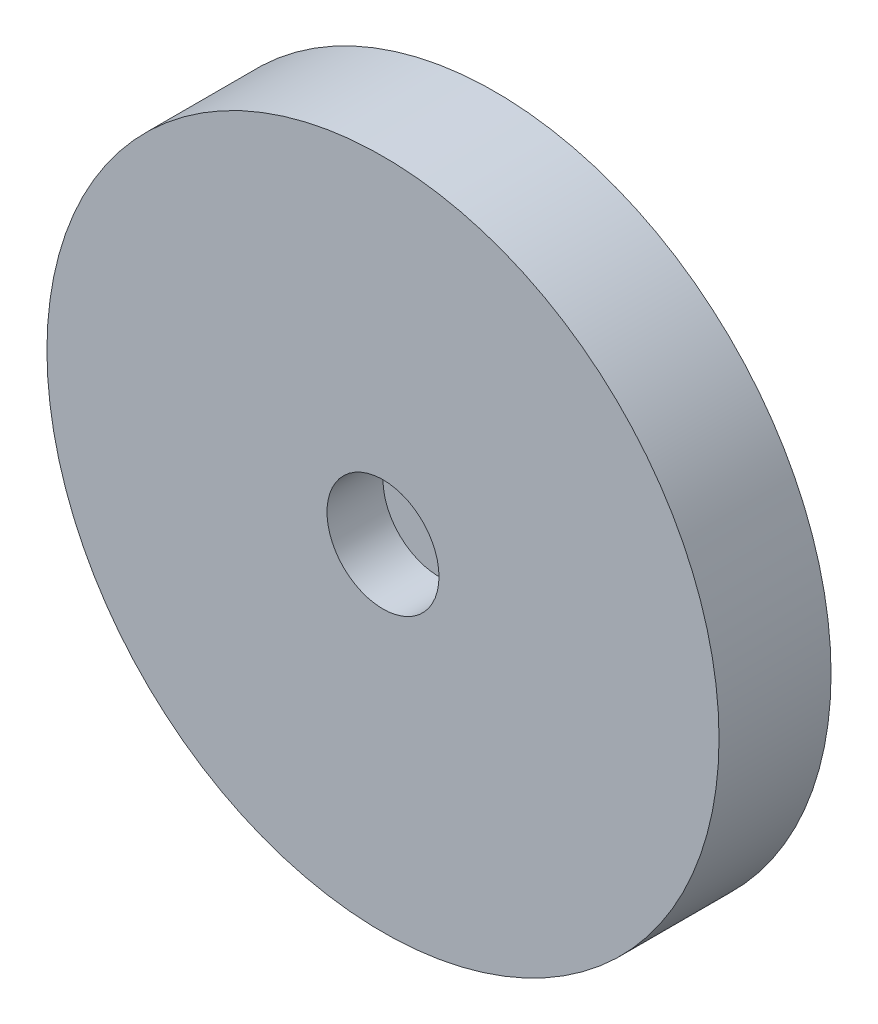
from build123d import *

# Parameters (mm, degrees)
SKETCH1_R           = 150
BOSS_EXTRUDE1_DEPTH = 50
SKETCH2_R           = 25
CUT_EXTRUDE1_DEPTH  = 25


with BuildPart() as part:
    # Sketch1 → Boss-Extrude1 (new body)
    with BuildSketch(Plane.XY):
        Circle(SKETCH1_R)
    extrude(amount=BOSS_EXTRUDE1_DEPTH)

    # Sketch2 → Cut-Extrude1 (cut)
    with BuildSketch(Plane.XY.offset(50)):
        Circle(SKETCH2_R)
    extrude(amount=-CUT_EXTRUDE1_DEPTH, mode=Mode.SUBTRACT)


solid = part.part
